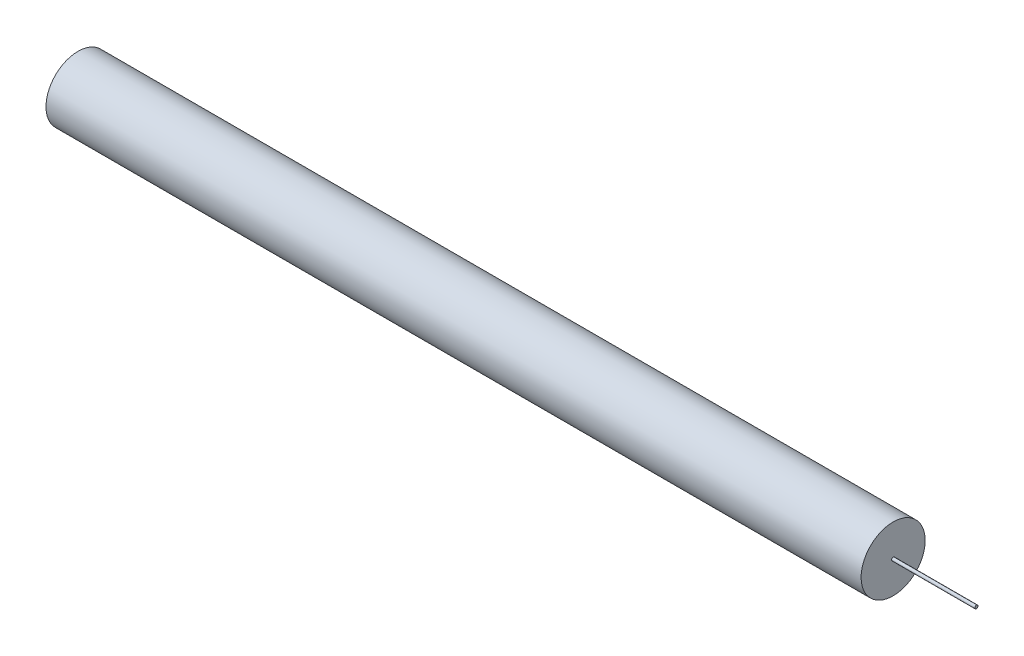
from build123d import *

# Parameters (mm, degrees)
SWEEP1_PROFILE_R = 20
SWEEP2_PROFILE_R = 1


with BuildPart() as part:
    # Sweep1: sweep along a path in Sketch1
    with BuildLine(Plane.XY) as sweep1_path:
        Line((0, 0), (509.085862196, 0))
    # Sweep1 profile (on start of the path) → Sweep1 (sweep)
    with BuildSketch(Plane.YZ):
        Circle(SWEEP1_PROFILE_R)
    sweep(path=sweep1_path.line)

    # Sweep2: sweep along a path in Sketch16
    with BuildLine(Plane.XY) as sweep2_path:
        Line((561.085862196, 0), (509.085862196, 0))
    # Sweep2 profile (on start of the path) → Sweep2 (sweep)
    with BuildSketch(Plane(origin=(561.085862196, 0, 0), x_dir=(0, -1, 0), z_dir=(-1, 0, 0))):
        Circle(SWEEP2_PROFILE_R)
    sweep(path=sweep2_path.line)


solid = part.part
